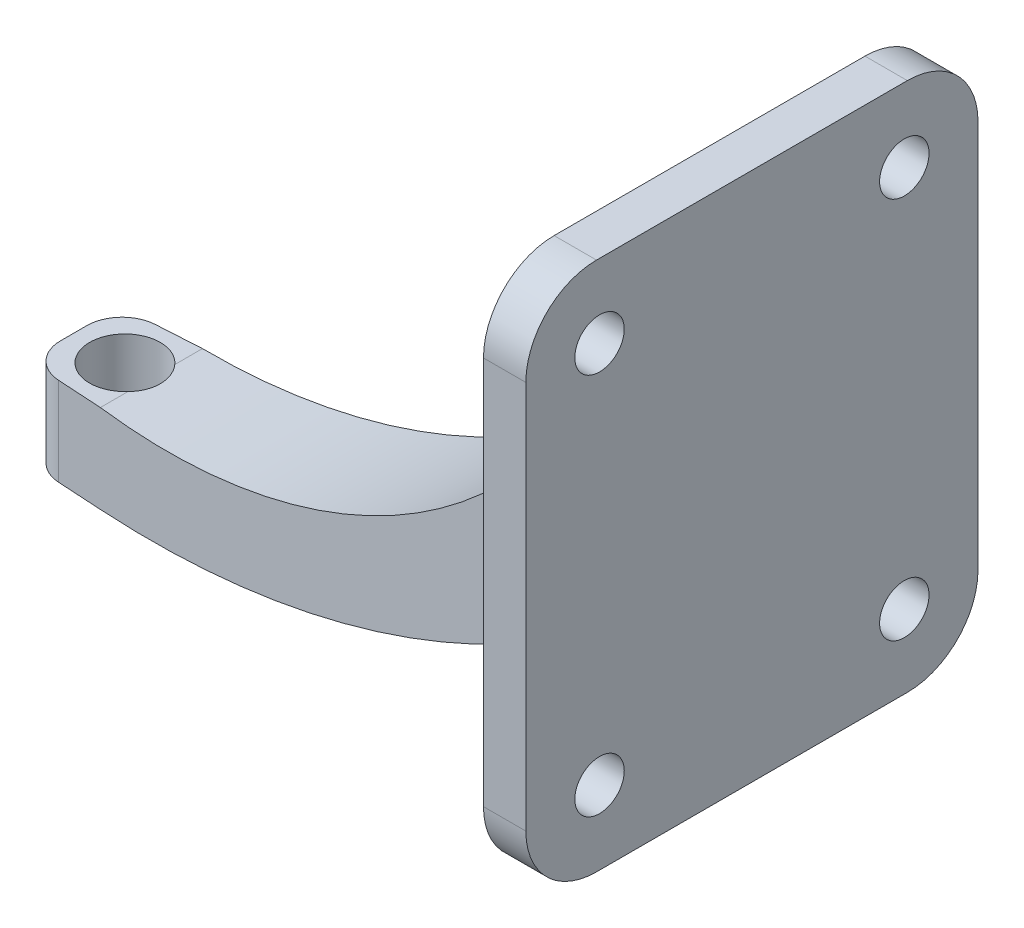
from build123d import *

# Parameters (mm, degrees)
BOSS_EXTRUDE1_DEPTH      = 48
BOSS_EXTRUDE4_DEPTH      = 40
BOSS_EXTRUDE4_DEPTH_BACK = 88
FILLET2_R                = 20
SKETCH10_R               = 7
CUT_EXTRUDE3_DEPTH       = 40
CUT_EXTRUDE4_DEPTH       = 180
SKETCH12_R               = 10
CUT_EXTRUDE5_DEPTH       = 180


with BuildPart() as part:
    # Sketch1 → Boss-Extrude1 (new body)
    with BuildSketch(Plane.XY):
        with BuildLine():
            Line((0, 0), (0, 25.00039893))
            Line((0, 25.00039893), (22, 25.00039893))
            ThreePointArc((22, 25.00039893), (119.156102476, 50.883868102), (180, 130.929369905))
            Line((180, 130.929369905), (180, 56.026453851))
            ThreePointArc((180, 56.026453851), (105.819692691, 14.421228989), (22, 0))
            Line((22, 0), (0, 0))
        make_face()
    extrude(amount=BOSS_EXTRUDE1_DEPTH)

    # Sketch9 → Boss-Extrude4 (add, two sides: drawn at the far end of the back side and taken through both)
    with BuildSketch(Plane.XY.offset(48).offset(-BOSS_EXTRUDE4_DEPTH_BACK)):
        Polygon((180, 130.929369905), (180, 160.929369905), (192, 160.929369905), (192, 10.929369905), (180, 10.929369905), (180, 51.308831421), align=None)
    extrude(amount=BOSS_EXTRUDE4_DEPTH + BOSS_EXTRUDE4_DEPTH_BACK)

    # Fillet2
    fillet2_edges = [part.edges().sort_by_distance(p)[0] for p in [
        (186, 160.929369905, -40),
        (186, 10.929369905, -40),
        (186, 10.929369905, 88),
        (186, 160.929369905, 88),
    ]]
    fillet(fillet2_edges, radius=FILLET2_R)

    # Sketch10 → Cut-Extrude3 (cut)
    with BuildSketch(Plane.ZY.offset(-180)):
        with Locations((-19.142135624, 140.071505529)):
            Circle(SKETCH10_R)
        with Locations((67.142135624, 140.071505529)):
            Circle(SKETCH10_R)
        with Locations((67.142135624, 31.787234281)):
            Circle(SKETCH10_R)
        with Locations((-19.142135624, 31.787234281)):
            Circle(SKETCH10_R)
    extrude(amount=-CUT_EXTRUDE3_DEPTH, mode=Mode.SUBTRACT)

    # Sketch11 → Cut-Extrude4 (cut)
    with BuildSketch(Plane(origin=(0, 0, 0), x_dir=(1, 0, 0), z_dir=(0, 1, 0))):
        with BuildLine():
            ThreePointArc((9.39659903, -10.313017355), (2.718722307, -13.440381836), (0, -20.294796118))
            Line((0, -20.294796118), (0, 0))
            Line((0, 0), (180, 0))
            Line((180, 0), (9.39659903, -10.313017355))
        make_face()
        with BuildLine():
            ThreePointArc((9.39659903, -37.686982645), (2.718722307, -34.559618164), (0, -27.705203882))
            Line((0, -27.705203882), (0, -48))
            Line((0, -48), (180, -48))
            Line((180, -48), (9.39659903, -37.686982645))
        make_face()
    extrude(amount=CUT_EXTRUDE4_DEPTH, mode=Mode.SUBTRACT)

    # Sketch12 → Cut-Extrude5 (cut)
    with BuildSketch(Plane(origin=(0, 25.00039893, 0), x_dir=(1, 0, 0), z_dir=(0, 1, 0))):
        with Locations(Location((14.5, -24, 0), (0, 0, 41.409622109))):
            Circle(SKETCH12_R)
    extrude(amount=-CUT_EXTRUDE5_DEPTH, mode=Mode.SUBTRACT)


solid = part.part
